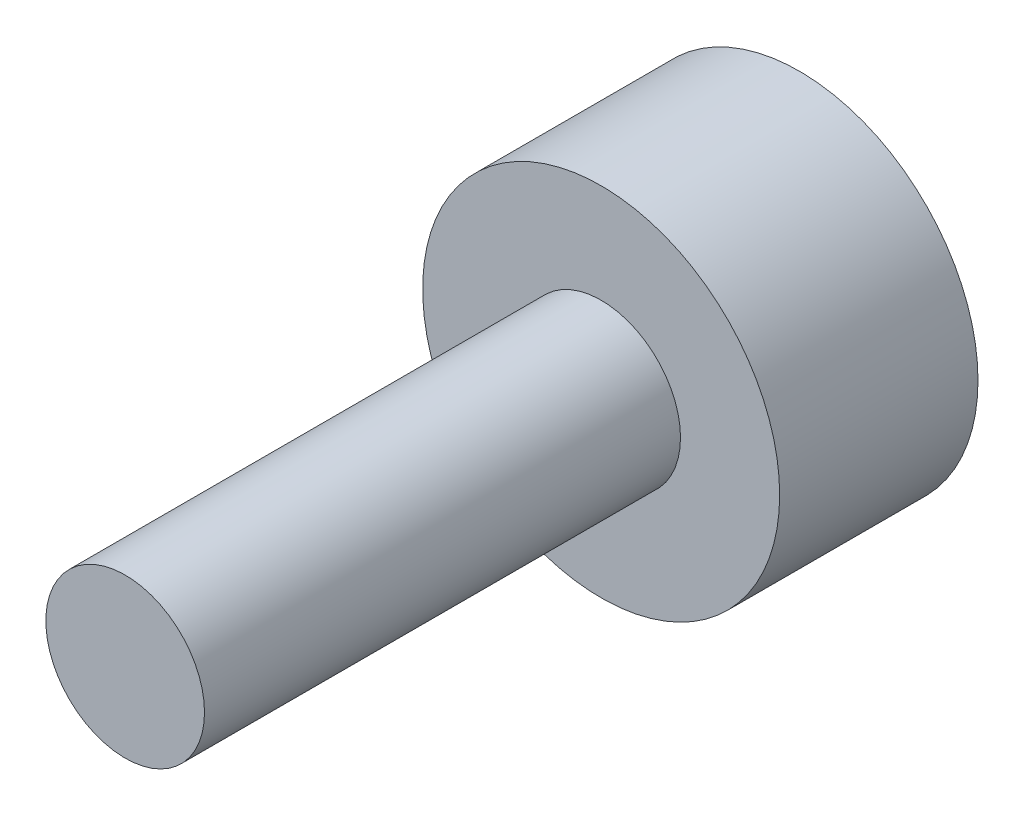
from build123d import *

# Parameters (mm, degrees)
SKETCH_1_R          = 2.25
EXTRUDE_1_DEPTH     = 2.5
SKETCH_2_R          = 1
EXTRUDE_2_DEPTH     = 6
CUT_EXTRUDE_1_DEPTH = 2


with BuildPart() as part:
    # ｽｹｯﾁ1 → ﾎﾞｽ - 押し出し1 (new body)
    with BuildSketch(Plane.XY):
        Circle(SKETCH_1_R)
    extrude(amount=EXTRUDE_1_DEPTH)

    # ｽｹｯﾁ2 → ﾎﾞｽ - 押し出し2 (add)
    with BuildSketch(Plane.XY.offset(2.5)):
        Circle(SKETCH_2_R)
    extrude(amount=EXTRUDE_2_DEPTH)

    # ｽｹｯﾁ3 → ｶｯﾄ - 押し出し1 (cut)
    with BuildSketch(Plane(origin=(0, 0, 0), x_dir=(-1, 0, 0), z_dir=(0, 0, -1))):
        Polygon((0.852242502, -0.763657679), (1.087468201, 0.356234818), (0.235225699, 1.119892496), (-0.852242502, 0.763657679), (-1.087468201, -0.356234818), (-0.235225699, -1.119892496), align=None)
    extrude(amount=-CUT_EXTRUDE_1_DEPTH, mode=Mode.SUBTRACT)


solid = part.part
